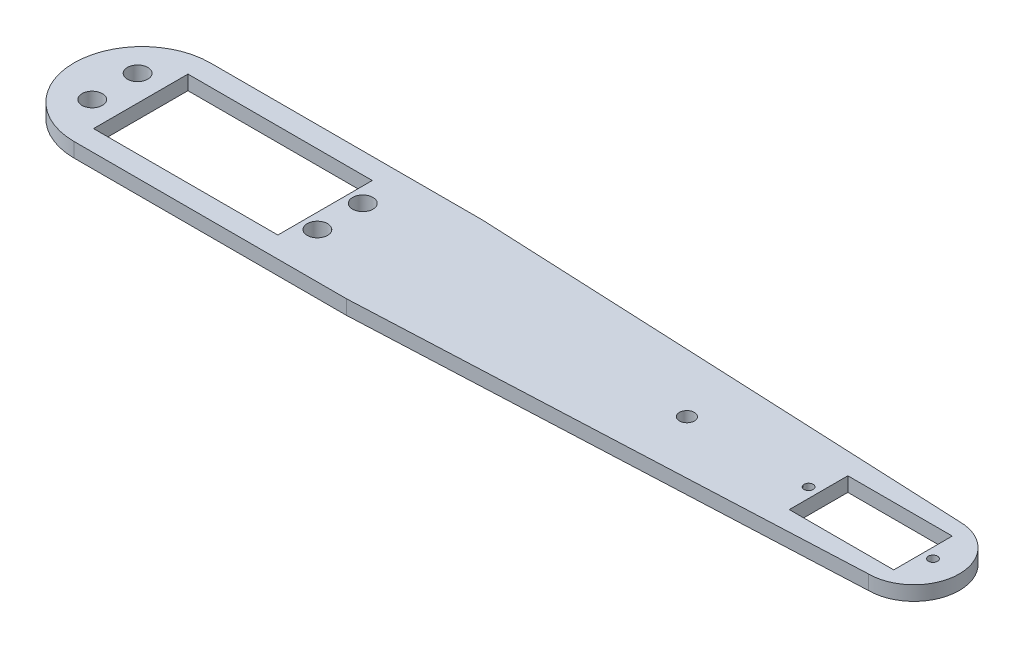
from build123d import *

# Parameters (mm, degrees)
SKETCH1_R           = 2.25
SKETCH1_R_2         = 1
SKETCH1_R_3         = 1.65
SKETCH1_W           = 40.6
SKETCH1_H           = 20.8
SKETCH1_W_2         = 23
SKETCH1_H_2         = 12.9
BOSS_EXTRUDE1_DEPTH = 3.175


with BuildPart() as part:
    # Sketch1 → Boss-Extrude1 (new body)
    with BuildSketch(Plane(origin=(0, 0, 0), x_dir=(1, 0, 0), z_dir=(0, 1, 0))):
        with BuildLine():
            Line((-162.38735588, 17.244652891), (-102.38735588, 17.244652891))
            Line((-102.38735588, 17.244652891), (7.61264412, 12.244652891))
            ThreePointArc((7.61264412, 12.244652891), (17.61264412, 2.244652891), (7.61264412, -7.755347109))
            Line((7.61264412, -7.755347109), (-102.38735588, -12.755347109))
            Line((-102.38735588, -12.755347109), (-162.38735588, -12.755347109))
            ThreePointArc((-162.38735588, -12.755347109), (-177.38735588, 2.244652891), (-162.38735588, 17.244652891))
        make_face()
        with Locations(Location((-168.38735588, 7.244652891, 0), (0, 0, 270))):
            Circle(SKETCH1_R, mode=Mode.SUBTRACT)
        with Locations(Location((-168.38735588, -2.755347109, 0), (0, 0, 270))):
            Circle(SKETCH1_R, mode=Mode.SUBTRACT)
        with Locations(Location((-118.78735588, 7.244652891, 0), (0, 0, 270))):
            Circle(SKETCH1_R, mode=Mode.SUBTRACT)
        with Locations(Location((-118.78735588, -2.755347109, 0), (0, 0, 270))):
            Circle(SKETCH1_R, mode=Mode.SUBTRACT)
        with Locations(Location((-15.58735588, 2.244652891, 0), (0, 0, 270))):
            Circle(SKETCH1_R_2, mode=Mode.SUBTRACT)
        with Locations(Location((11.81264412, 2.244652891, 0), (0, 0, 270))):
            Circle(SKETCH1_R_2, mode=Mode.SUBTRACT)
        with Locations(Location((-42.38735588, 2.244652891, 0), (0, 0, 270))):
            Circle(SKETCH1_R_3, mode=Mode.SUBTRACT)
        with Locations((-142.392621679, 2.244652891)):
            Rectangle(SKETCH1_W, SKETCH1_H, mode=Mode.SUBTRACT)
        with Locations((-1.88735588, 2.244652891)):
            Rectangle(SKETCH1_W_2, SKETCH1_H_2, mode=Mode.SUBTRACT)
    extrude(amount=BOSS_EXTRUDE1_DEPTH)


solid = part.part
